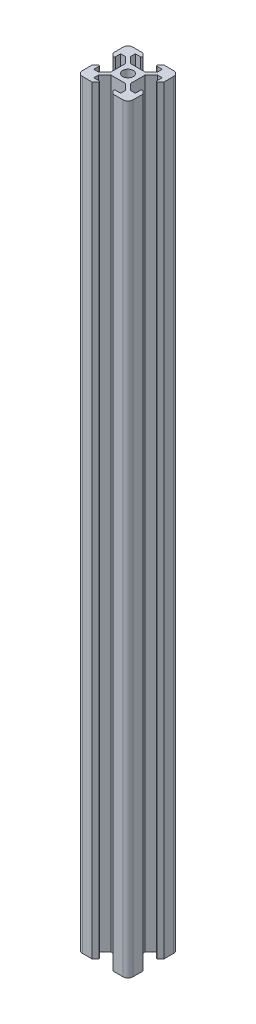
from build123d import *

# Parameters (mm, degrees)
CROQUIS1_R              = 2.1
SALIENTE_EXTRUIR2_DEPTH = 300


with BuildPart() as part:
    # Croquis1 → Saliente-Extruir2 (new body)
    with BuildSketch(Plane(origin=(0, 0, 0), x_dir=(1, 0, 0), z_dir=(0, 1, 0))):
        with BuildLine():
            Line((3.9, -2.84), (3.9, 2.84))
            Line((3.9, 2.84), (6.36, 5.3))
            Line((6.36, 5.3), (8.2, 5.3))
            Line((8.2, 5.3), (8.2, 3.34))
            ThreePointArc((8.2, 3.34), (8.346446609, 2.986446609), (8.7, 2.84))
            Line((8.7, 2.84), (10, 4.14))
            Line((10, 4.14), (10, 8))
            ThreePointArc((10, 8), (9.414213562, 9.414213562), (8, 10))
            Line((8, 10), (4.14, 10))
            Line((4.14, 10), (2.84, 8.7))
            ThreePointArc((2.84, 8.7), (2.986446609, 8.346446609), (3.34, 8.2))
            Line((3.34, 8.2), (5.3, 8.2))
            Line((5.3, 8.2), (5.3, 6.36))
            Line((5.3, 6.36), (2.84, 3.9))
            Line((2.84, 3.9), (-2.84, 3.9))
            Line((-2.84, 3.9), (-5.3, 6.36))
            Line((-5.3, 6.36), (-5.3, 8.2))
            Line((-5.3, 8.2), (-3.34, 8.2))
            ThreePointArc((-3.34, 8.2), (-2.986446609, 8.346446609), (-2.84, 8.7))
            Line((-2.84, 8.7), (-4.14, 10))
            Line((-4.14, 10), (-8, 10))
            ThreePointArc((-8, 10), (-9.414213562, 9.414213562), (-10, 8))
            Line((-10, 8), (-10, 4.14))
            Line((-10, 4.14), (-8.7, 2.84))
            ThreePointArc((-8.7, 2.84), (-8.346446609, 2.986446609), (-8.2, 3.34))
            Line((-8.2, 3.34), (-8.2, 5.3))
            Line((-8.2, 5.3), (-6.36, 5.3))
            Line((-6.36, 5.3), (-3.9, 2.84))
            Line((-3.9, 2.84), (-3.9, -2.84))
            Line((-3.9, -2.84), (-6.36, -5.3))
            Line((-6.36, -5.3), (-8.2, -5.3))
            Line((-8.2, -5.3), (-8.2, -3.34))
            ThreePointArc((-8.2, -3.34), (-8.346446609, -2.986446609), (-8.7, -2.84))
            Line((-8.7, -2.84), (-10, -4.14))
            Line((-10, -4.14), (-10, -8))
            ThreePointArc((-10, -8), (-9.414213562, -9.414213562), (-8, -10))
            Line((-8, -10), (-4.14, -10))
            Line((-4.14, -10), (-2.84, -8.7))
            ThreePointArc((-2.84, -8.7), (-2.986446609, -8.346446609), (-3.34, -8.2))
            Line((-3.34, -8.2), (-5.3, -8.2))
            Line((-5.3, -8.2), (-5.3, -6.36))
            Line((-5.3, -6.36), (-2.84, -3.9))
            Line((-2.84, -3.9), (2.84, -3.9))
            Line((2.84, -3.9), (5.3, -6.36))
            Line((5.3, -6.36), (5.3, -8.2))
            Line((5.3, -8.2), (3.34, -8.2))
            ThreePointArc((3.34, -8.2), (2.986446609, -8.346446609), (2.84, -8.7))
            Line((2.84, -8.7), (4.14, -10))
            Line((4.14, -10), (8, -10))
            ThreePointArc((8, -10), (9.414213562, -9.414213562), (10, -8))
            Line((10, -8), (10, -4.14))
            Line((10, -4.14), (8.7, -2.84))
            ThreePointArc((8.7, -2.84), (8.346446609, -2.986446609), (8.2, -3.34))
            Line((8.2, -3.34), (8.2, -5.3))
            Line((8.2, -5.3), (6.36, -5.3))
            Line((6.36, -5.3), (3.9, -2.84))
        make_face()
        with Locations(Location((0, 0, 0), (0, 0, 270))):
            Circle(CROQUIS1_R, mode=Mode.SUBTRACT)
    extrude(amount=SALIENTE_EXTRUIR2_DEPTH)


solid = part.part
